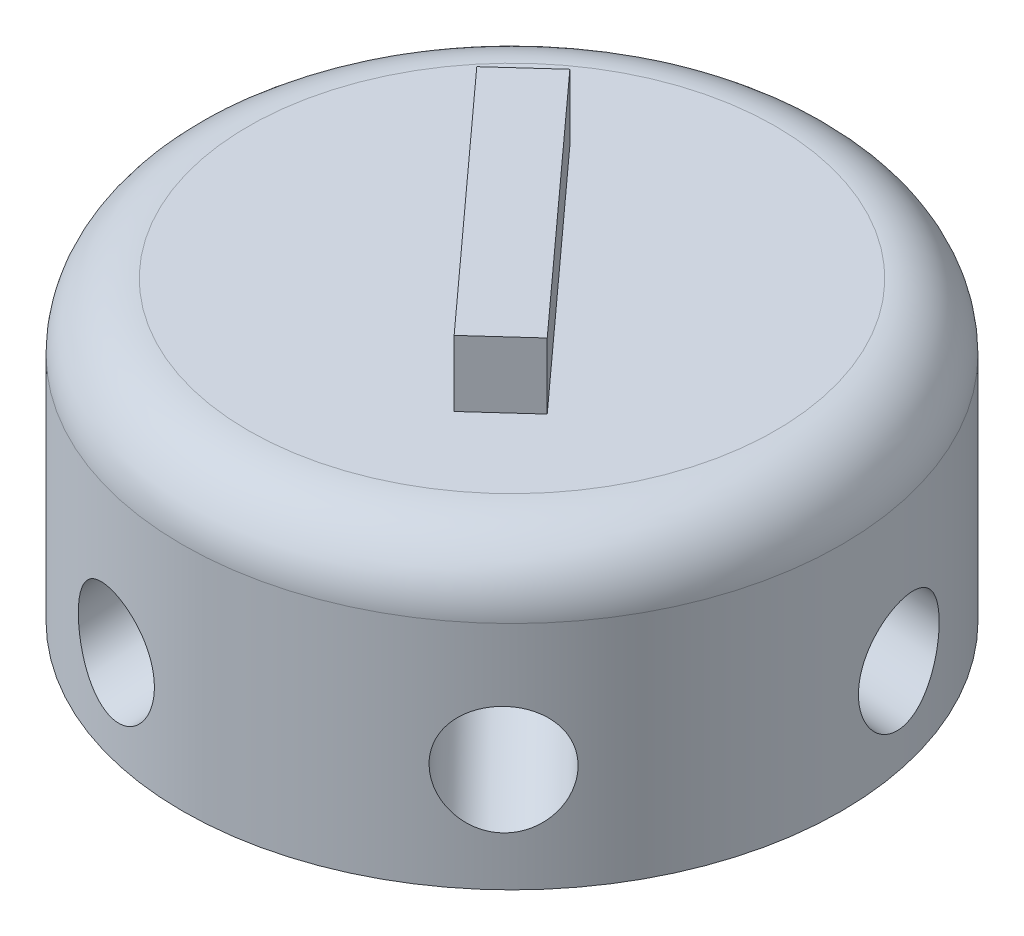
from build123d import *

# Parameters (mm, degrees)
BASE_DEPTH          = 3
BASE_DEPTH_BACK     = 6
SKETCH1_R           = 10
SKETCH2_R           = 1.6
HOLE1_DEPTH         = 19.646604683
HOLE1MIRROR_COUNT   = 2
SKETCH3_R           = 1.6
HOLE2_DEPTH         = 19.158121362
HOLE2MIRROR_COUNT   = 2
SKETCH4_R           = 1.6
HOLE3_DEPTH         = 19.100993715
HOLE3MIRROR_COUNT   = 2
FILLET1_R           = 2
BOSS_EXTRUDE1_DEPTH = 2


with BuildPart() as part:
    # Sketch1 → base (new, two sides: drawn at the far end of the back side and taken through both)
    with BuildSketch(Plane(origin=(0, 0, 0), x_dir=(1, 0, 0), z_dir=(0, 1, 0)).offset(-BASE_DEPTH_BACK)):
        Circle(SKETCH1_R)
    extrude(amount=BASE_DEPTH + BASE_DEPTH_BACK)

    # Sketch2 → hole1 (cut, through all)
    with BuildSketch(Plane(origin=(2.670502563, -1.093066116, 2.770130417), x_dir=(-0.6558691872850446, 0.22429081675253856, 0.7207837669443827), z_dir=(-0.6676256406563905, 0.27326652891267483, -0.692532604369038))):
        Circle(SKETCH2_R)
    hole1 = extrude(amount=-HOLE1_DEPTH, mode=Mode.SUBTRACT)

    # hole1mirror: hole1 ×2 about axis
    hole1mirror_axis = Axis((0, 5.5, 0), (0, -1, 0))
    for i in range(1, HOLE1MIRROR_COUNT):
        add(hole1.rotate(hole1mirror_axis, i * 360 / HOLE1MIRROR_COUNT), mode=Mode.SUBTRACT)

    # Sketch3 → hole2 (cut, through all)
    with BuildSketch(Plane(origin=(-0.941672921, -1.236067977, 3.685836142), x_dir=(-0.9718935871364875, 0.07382318789513377, -0.22354639834264944), z_dir=(0.23541823021467095, 0.3090169943749464, -0.921459035481267))):
        Circle(SKETCH3_R)
    hole2 = extrude(amount=-HOLE2_DEPTH, mode=Mode.SUBTRACT)

    # hole2mirror: hole2 ×2 about axis
    hole2mirror_axis = Axis((0, 5.5, 0), (0, -1, 0))
    for i in range(1, HOLE2MIRROR_COUNT):
        add(hole2.rotate(hole2mirror_axis, i * 360 / HOLE2MIRROR_COUNT), mode=Mode.SUBTRACT)

    # Sketch4 → hole3 (cut, through all)
    with BuildSketch(Plane(origin=(-3.717841, -1.236067977, 0.806098168), x_dir=(-0.19123247894507908, -0.06357892752956036, -0.979483465389136), z_dir=(0.9294602499075393, 0.30901699437494623, -0.20152454200243008))):
        Circle(SKETCH4_R)
    hole3 = extrude(amount=-HOLE3_DEPTH, mode=Mode.SUBTRACT)

    # hole3mirror: hole3 ×2 about axis
    hole3mirror_axis = Axis((0, 5.5, 0), (0, -1, 0))
    for i in range(1, HOLE3MIRROR_COUNT):
        add(hole3.rotate(hole3mirror_axis, i * 360 / HOLE3MIRROR_COUNT), mode=Mode.SUBTRACT)

    # Fillet1
    fillet1_edges = [part.edges().sort_by_distance(p)[0] for p in [
        (-10, 3, 0),
    ]]
    fillet(fillet1_edges, radius=FILLET1_R)

    # Sketch6 → Boss-Extrude1 (add)
    with BuildSketch(Plane(origin=(0, 3, 0), x_dir=(1, 0, 0), z_dir=(0, 1, 0))):
        Polygon((-4.100143947, 3.031306586), (-2.61886111, 4.375107597), (4.100143947, -3.031306586), (2.61886111, -4.375107597), align=None)
    extrude(amount=BOSS_EXTRUDE1_DEPTH)


solid = part.part
